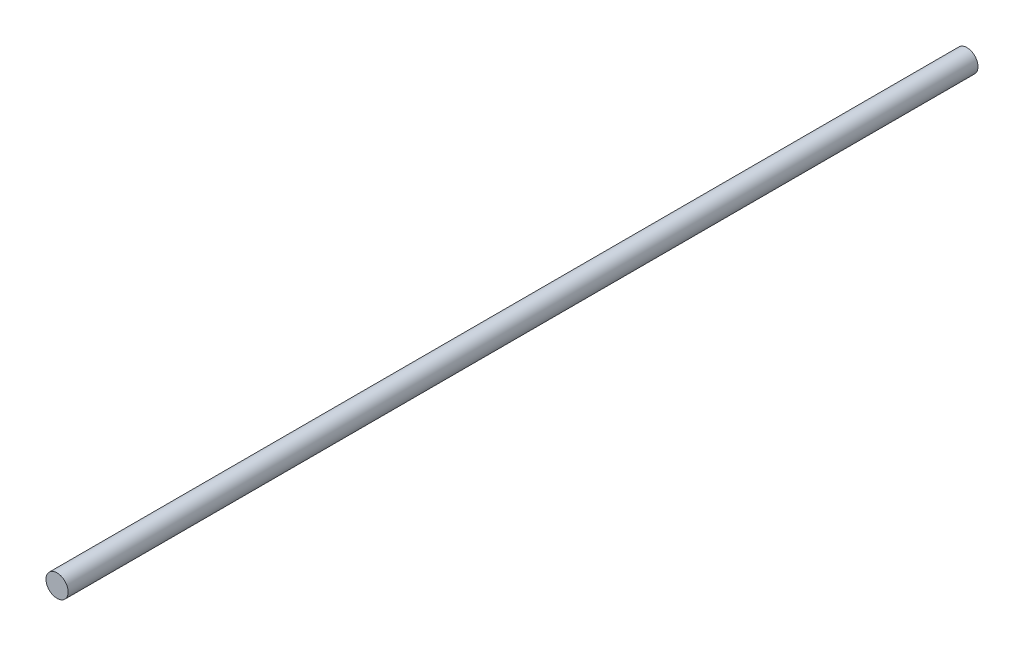
from build123d import *

# Parameters (mm, degrees)
SKETCH2_R           = 6.45
BOSS_EXTRUDE1_DEPTH = 530


with BuildPart() as part:
    # Sketch2 → Boss-Extrude1 (new body)
    with BuildSketch(Plane.XY):
        Circle(SKETCH2_R)
    extrude(amount=BOSS_EXTRUDE1_DEPTH)


solid = part.part
